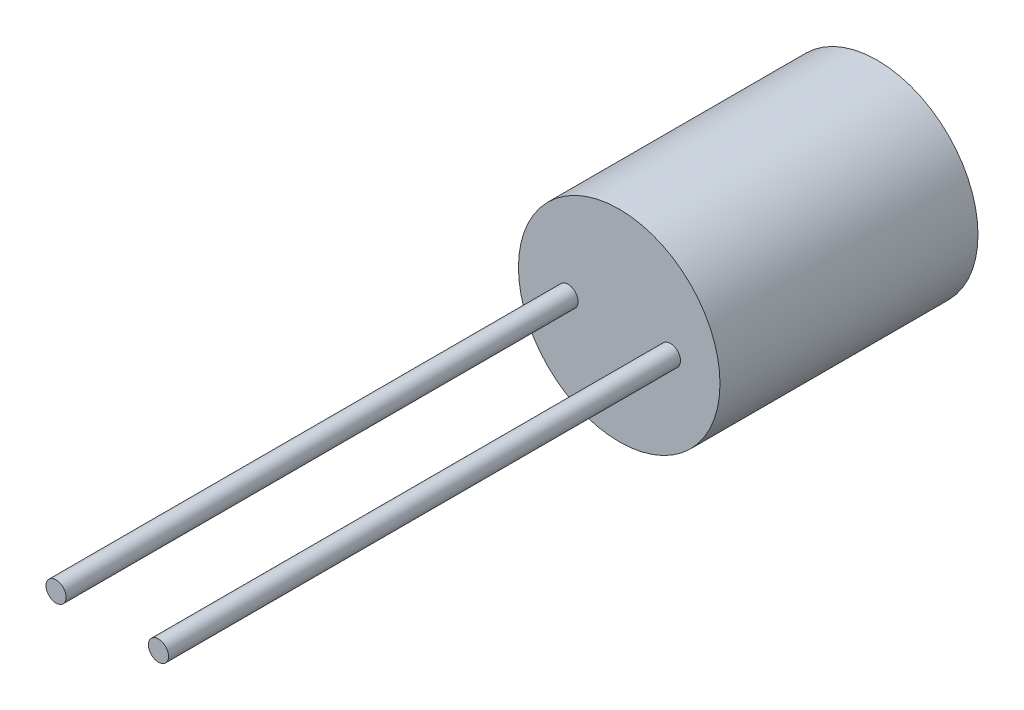
from build123d import *

# Parameters (mm, degrees)
SKETCH_1_R      = 2.5
EXTRUDE_1_DEPTH = 5.4
SKETCH_2_R      = 2.5
EXTRUDE_2_DEPTH = 1
SKETCH_3_R      = 0.25
EXTRUDE_3_DEPTH = 12.7


with BuildPart() as part:
    # 草图1 → 拉伸1 (new body)
    with BuildSketch(Plane.XY):
        with Locations(Location((0, 0, 0), (0, 0, 180))):
            Circle(SKETCH_1_R)
    extrude(amount=EXTRUDE_1_DEPTH)

    # 草图2 → 拉伸2 (add)
    with BuildSketch(Plane.XY.offset(5.4)):
        with Locations(Location((0, 0, 0), (0, 0, 180))):
            Circle(SKETCH_2_R)
    extrude(amount=EXTRUDE_2_DEPTH)

    # 草图3 → 拉伸3 (add)
    with BuildSketch(Plane.XY.offset(6.4)):
        with Locations((-1.27, 0)):
            Circle(SKETCH_3_R)
        with Locations(Location((1.27, 0, 0), (0, 0, 180))):
            Circle(SKETCH_3_R)
    extrude(amount=EXTRUDE_3_DEPTH)


solid = part.part
